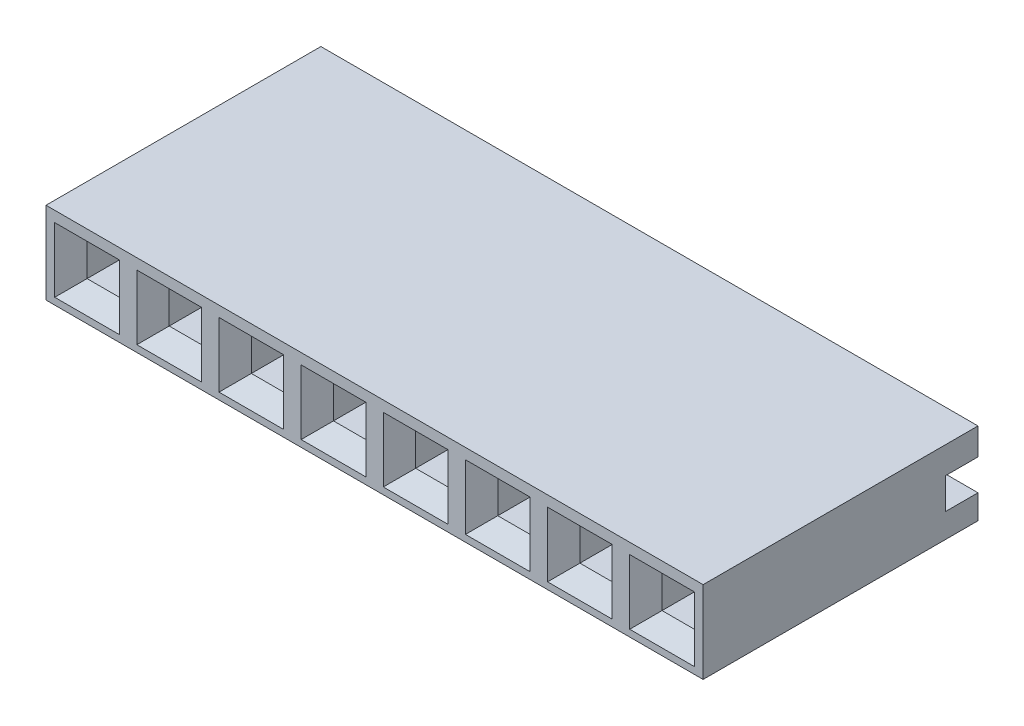
from build123d import *

# Parameters (mm, degrees)
BOSS_EXTRUDE1_DEPTH       = 20.32
SKETCH2_W                 = 2
SKETCH2_H                 = 0.6
CUT_EXTRUDE1_DEPTH        = 5.5
SKETCH3_W                 = 1
SKETCH3_H                 = 1
CUT_EXTRUDE2_DEPTH        = 6
SKETCH4_W                 = 2
SKETCH4_H                 = 2
CUT_EXTRUDE3_DEPTH        = 0.5
CUT_EXTRUDE3_DRAFT        = -45
LPATTERN1_COUNT           = 8
LPATTERN1_PITCH           = 2.54
LPATTERN1_COPY_1_SKETCH_W = 2
LPATTERN1_COPY_1_SKETCH_H = 2
LPATTERN1_COPY_1_DEPTH    = 0.5
LPATTERN1_COPY_1_DRAFT    = -45
LPATTERN1_COPY_2_SKETCH_W = 2
LPATTERN1_COPY_2_SKETCH_H = 2
LPATTERN1_COPY_2_DEPTH    = 0.5
LPATTERN1_COPY_2_DRAFT    = -45
LPATTERN1_COPY_3_SKETCH_W = 2
LPATTERN1_COPY_3_SKETCH_H = 2
LPATTERN1_COPY_3_DEPTH    = 0.5
LPATTERN1_COPY_3_DRAFT    = -45
LPATTERN1_COPY_4_SKETCH_W = 2
LPATTERN1_COPY_4_SKETCH_H = 2
LPATTERN1_COPY_4_DEPTH    = 0.5
LPATTERN1_COPY_4_DRAFT    = -45
LPATTERN1_COPY_5_SKETCH_W = 2
LPATTERN1_COPY_5_SKETCH_H = 2
LPATTERN1_COPY_5_DEPTH    = 0.5
LPATTERN1_COPY_5_DRAFT    = -45
LPATTERN1_COPY_6_SKETCH_W = 2
LPATTERN1_COPY_6_SKETCH_H = 2
LPATTERN1_COPY_6_DEPTH    = 0.5
LPATTERN1_COPY_6_DRAFT    = -45
LPATTERN1_COPY_7_SKETCH_W = 2
LPATTERN1_COPY_7_SKETCH_H = 2
LPATTERN1_COPY_7_DEPTH    = 0.5
LPATTERN1_COPY_7_DRAFT    = -45


with BuildPart() as part:
    # Sketch1 → Boss-Extrude1 (new body)
    with BuildSketch(Plane(origin=(0, 0, 0), x_dir=(0, 0, -1), z_dir=(1, 0, 0))):
        Polygon((8.5, 2.54), (0, 2.54), (0, 0), (8.5, 0), (8.5, 0.75), (7.5, 0.75), (7.5, 1.709993), (8.5, 1.709993), align=None)
    extrude(amount=-BOSS_EXTRUDE1_DEPTH)

    # Sketch2 → Cut-Extrude1 (cut)
    with BuildSketch(Plane(origin=(0, 0, -7.5), x_dir=(-1, 0, 0), z_dir=(0, 0, -1))):
        with Locations((1.27, 1.409993)):
            Rectangle(SKETCH2_W, SKETCH2_H)
    cut_extrude1 = extrude(amount=-CUT_EXTRUDE1_DEPTH, mode=Mode.SUBTRACT)

    # Sketch3 → Cut-Extrude2 (cut)
    with BuildSketch(Plane(origin=(0, 0, 0), x_dir=(-1, 0, 0), z_dir=(0, 0, -1))):
        with Locations((1.27, 1.209993)):
            Rectangle(SKETCH3_W, SKETCH3_H)
    cut_extrude2 = extrude(amount=CUT_EXTRUDE2_DEPTH, mode=Mode.SUBTRACT)


with BuildPart() as cut_extrude3_tool:
    # Sketch4 → Cut-Extrude3 (with draft: the straight prism first)
    with BuildSketch(Plane.XY):
        with Locations((-1.27, 1.209993)):
            Rectangle(SKETCH4_W, SKETCH4_H)
    extrude(amount=-CUT_EXTRUDE3_DEPTH)
    # Cut-Extrude3: the draft: its side faces are tilted about the plane it starts from
    cut_extrude3_sides = [cut_extrude3_tool.faces().sort_by_distance(p)[0] for p in [
        (-2.27, 1.209993, -0.25),
        (-1.27, 0.209993, -0.25),
        (-0.27, 1.209993, -0.25),
        (-1.27, 2.209993, -0.25),
    ]]
    draft(cut_extrude3_sides, Plane.XY, CUT_EXTRUDE3_DRAFT)


with BuildPart() as part_1:
    add(part.part)

    # Cut-Extrude3: cut by cut_extrude3_tool
    add(cut_extrude3_tool.part, mode=Mode.SUBTRACT)

    # LPattern1: Cut-Extrude1, Cut-Extrude2 ×8
    with Locations(*[(-i * LPATTERN1_PITCH, 0, 0) for i in range(1, LPATTERN1_COUNT)]):
        add(cut_extrude1, mode=Mode.SUBTRACT)
        add(cut_extrude2, mode=Mode.SUBTRACT)


with BuildPart() as lpattern1_copy_1_tool:
    # LPattern1 copy 1 sketch → LPattern1 copy 1 (with draft: the straight prism first)
    with BuildSketch(Plane(origin=(-2.54, 0, 0), x_dir=(1, 0, 0), z_dir=(0, 0, 1))):
        with Locations((-1.27, 1.209993)):
            Rectangle(LPATTERN1_COPY_1_SKETCH_W, LPATTERN1_COPY_1_SKETCH_H)
    extrude(amount=-LPATTERN1_COPY_1_DEPTH)
    # LPattern1 copy 1: the draft: its side faces are tilted about the plane it starts from
    lpattern1_copy_1_sides = [lpattern1_copy_1_tool.faces().sort_by_distance(p)[0] for p in [
        (-4.81, 1.209993, -0.25),
        (-3.81, 0.209993, -0.25),
        (-2.81, 1.209993, -0.25),
        (-3.81, 2.209993, -0.25),
    ]]
    draft(lpattern1_copy_1_sides, Plane(origin=(-2.54, 0, 0), x_dir=(1, 0, 0), z_dir=(0, 0, 1)), LPATTERN1_COPY_1_DRAFT)


with BuildPart() as part_2:
    add(part_1.part)

    # LPattern1 copy 1: cut by lpattern1_copy_1_tool
    add(lpattern1_copy_1_tool.part, mode=Mode.SUBTRACT)


with BuildPart() as lpattern1_copy_2_tool:
    # LPattern1 copy 2 sketch → LPattern1 copy 2 (with draft: the straight prism first)
    with BuildSketch(Plane(origin=(-5.08, 0, 0), x_dir=(1, 0, 0), z_dir=(0, 0, 1))):
        with Locations((-1.27, 1.209993)):
            Rectangle(LPATTERN1_COPY_2_SKETCH_W, LPATTERN1_COPY_2_SKETCH_H)
    extrude(amount=-LPATTERN1_COPY_2_DEPTH)
    # LPattern1 copy 2: the draft: its side faces are tilted about the plane it starts from
    lpattern1_copy_2_sides = [lpattern1_copy_2_tool.faces().sort_by_distance(p)[0] for p in [
        (-7.35, 1.209993, -0.25),
        (-6.35, 0.209993, -0.25),
        (-5.35, 1.209993, -0.25),
        (-6.35, 2.209993, -0.25),
    ]]
    draft(lpattern1_copy_2_sides, Plane(origin=(-5.08, 0, 0), x_dir=(1, 0, 0), z_dir=(0, 0, 1)), LPATTERN1_COPY_2_DRAFT)


with BuildPart() as part_3:
    add(part_2.part)

    # LPattern1 copy 2: cut by lpattern1_copy_2_tool
    add(lpattern1_copy_2_tool.part, mode=Mode.SUBTRACT)


with BuildPart() as lpattern1_copy_3_tool:
    # LPattern1 copy 3 sketch → LPattern1 copy 3 (with draft: the straight prism first)
    with BuildSketch(Plane(origin=(-7.62, 0, 0), x_dir=(1, 0, 0), z_dir=(0, 0, 1))):
        with Locations((-1.27, 1.209993)):
            Rectangle(LPATTERN1_COPY_3_SKETCH_W, LPATTERN1_COPY_3_SKETCH_H)
    extrude(amount=-LPATTERN1_COPY_3_DEPTH)
    # LPattern1 copy 3: the draft: its side faces are tilted about the plane it starts from
    lpattern1_copy_3_sides = [lpattern1_copy_3_tool.faces().sort_by_distance(p)[0] for p in [
        (-9.89, 1.209993, -0.25),
        (-8.89, 0.209993, -0.25),
        (-7.89, 1.209993, -0.25),
        (-8.89, 2.209993, -0.25),
    ]]
    draft(lpattern1_copy_3_sides, Plane(origin=(-7.62, 0, 0), x_dir=(1, 0, 0), z_dir=(0, 0, 1)), LPATTERN1_COPY_3_DRAFT)


with BuildPart() as part_4:
    add(part_3.part)

    # LPattern1 copy 3: cut by lpattern1_copy_3_tool
    add(lpattern1_copy_3_tool.part, mode=Mode.SUBTRACT)


with BuildPart() as lpattern1_copy_4_tool:
    # LPattern1 copy 4 sketch → LPattern1 copy 4 (with draft: the straight prism first)
    with BuildSketch(Plane(origin=(-10.16, 0, 0), x_dir=(1, 0, 0), z_dir=(0, 0, 1))):
        with Locations((-1.27, 1.209993)):
            Rectangle(LPATTERN1_COPY_4_SKETCH_W, LPATTERN1_COPY_4_SKETCH_H)
    extrude(amount=-LPATTERN1_COPY_4_DEPTH)
    # LPattern1 copy 4: the draft: its side faces are tilted about the plane it starts from
    lpattern1_copy_4_sides = [lpattern1_copy_4_tool.faces().sort_by_distance(p)[0] for p in [
        (-12.43, 1.209993, -0.25),
        (-11.43, 0.209993, -0.25),
        (-10.43, 1.209993, -0.25),
        (-11.43, 2.209993, -0.25),
    ]]
    draft(lpattern1_copy_4_sides, Plane(origin=(-10.16, 0, 0), x_dir=(1, 0, 0), z_dir=(0, 0, 1)), LPATTERN1_COPY_4_DRAFT)


with BuildPart() as part_5:
    add(part_4.part)

    # LPattern1 copy 4: cut by lpattern1_copy_4_tool
    add(lpattern1_copy_4_tool.part, mode=Mode.SUBTRACT)


with BuildPart() as lpattern1_copy_5_tool:
    # LPattern1 copy 5 sketch → LPattern1 copy 5 (with draft: the straight prism first)
    with BuildSketch(Plane(origin=(-12.7, 0, 0), x_dir=(1, 0, 0), z_dir=(0, 0, 1))):
        with Locations((-1.27, 1.209993)):
            Rectangle(LPATTERN1_COPY_5_SKETCH_W, LPATTERN1_COPY_5_SKETCH_H)
    extrude(amount=-LPATTERN1_COPY_5_DEPTH)
    # LPattern1 copy 5: the draft: its side faces are tilted about the plane it starts from
    lpattern1_copy_5_sides = [lpattern1_copy_5_tool.faces().sort_by_distance(p)[0] for p in [
        (-14.97, 1.209993, -0.25),
        (-13.97, 0.209993, -0.25),
        (-12.97, 1.209993, -0.25),
        (-13.97, 2.209993, -0.25),
    ]]
    draft(lpattern1_copy_5_sides, Plane(origin=(-12.7, 0, 0), x_dir=(1, 0, 0), z_dir=(0, 0, 1)), LPATTERN1_COPY_5_DRAFT)


with BuildPart() as part_6:
    add(part_5.part)

    # LPattern1 copy 5: cut by lpattern1_copy_5_tool
    add(lpattern1_copy_5_tool.part, mode=Mode.SUBTRACT)


with BuildPart() as lpattern1_copy_6_tool:
    # LPattern1 copy 6 sketch → LPattern1 copy 6 (with draft: the straight prism first)
    with BuildSketch(Plane(origin=(-15.24, 0, 0), x_dir=(1, 0, 0), z_dir=(0, 0, 1))):
        with Locations((-1.27, 1.209993)):
            Rectangle(LPATTERN1_COPY_6_SKETCH_W, LPATTERN1_COPY_6_SKETCH_H)
    extrude(amount=-LPATTERN1_COPY_6_DEPTH)
    # LPattern1 copy 6: the draft: its side faces are tilted about the plane it starts from
    lpattern1_copy_6_sides = [lpattern1_copy_6_tool.faces().sort_by_distance(p)[0] for p in [
        (-17.51, 1.209993, -0.25),
        (-16.51, 0.209993, -0.25),
        (-15.51, 1.209993, -0.25),
        (-16.51, 2.209993, -0.25),
    ]]
    draft(lpattern1_copy_6_sides, Plane(origin=(-15.24, 0, 0), x_dir=(1, 0, 0), z_dir=(0, 0, 1)), LPATTERN1_COPY_6_DRAFT)


with BuildPart() as part_7:
    add(part_6.part)

    # LPattern1 copy 6: cut by lpattern1_copy_6_tool
    add(lpattern1_copy_6_tool.part, mode=Mode.SUBTRACT)


with BuildPart() as lpattern1_copy_7_tool:
    # LPattern1 copy 7 sketch → LPattern1 copy 7 (with draft: the straight prism first)
    with BuildSketch(Plane(origin=(-17.78, 0, 0), x_dir=(1, 0, 0), z_dir=(0, 0, 1))):
        with Locations((-1.27, 1.209993)):
            Rectangle(LPATTERN1_COPY_7_SKETCH_W, LPATTERN1_COPY_7_SKETCH_H)
    extrude(amount=-LPATTERN1_COPY_7_DEPTH)
    # LPattern1 copy 7: the draft: its side faces are tilted about the plane it starts from
    lpattern1_copy_7_sides = [lpattern1_copy_7_tool.faces().sort_by_distance(p)[0] for p in [
        (-20.05, 1.209993, -0.25),
        (-19.05, 0.209993, -0.25),
        (-18.05, 1.209993, -0.25),
        (-19.05, 2.209993, -0.25),
    ]]
    draft(lpattern1_copy_7_sides, Plane(origin=(-17.78, 0, 0), x_dir=(1, 0, 0), z_dir=(0, 0, 1)), LPATTERN1_COPY_7_DRAFT)


with BuildPart() as part_8:
    add(part_7.part)

    # LPattern1 copy 7: cut by lpattern1_copy_7_tool
    add(lpattern1_copy_7_tool.part, mode=Mode.SUBTRACT)


solid = part_8.part
